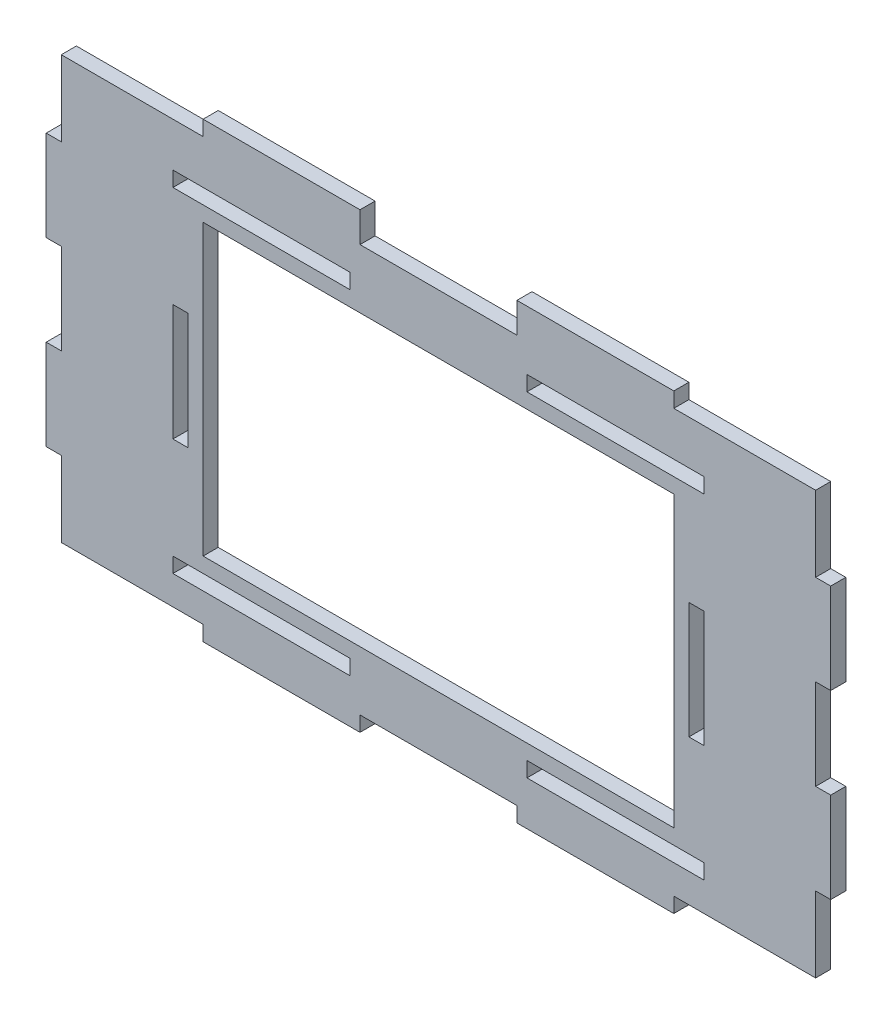
from build123d import *

# Parameters (mm, degrees)
SALIENTE_EXTRUIR1_DEPTH = 5
CROQUIS2_W              = 52
CROQUIS2_H              = 5
CORTAR_EXTRUIR1_DEPTH   = 10
CROQUIS3_W              = 5
CROQUIS3_H              = 38.6
CROQUIS3_W_2            = 156
CROQUIS3_H_2            = 95.8
CORTAR_EXTRUIR2_DEPTH   = 10


with BuildPart() as part:
    # Croquis1 → Saliente-Extruir1 (new body)
    with BuildSketch(Plane.XY):
        Polygon((52, 0), (104, 0), (104, 5), (156, 5), (156, 0), (208, 0), (208, 5), (255, 5), (255, 30), (260, 30), (260, 60), (255, 60), (255, 90), (260, 90), (260, 120), (255, 120), (255, 145), (208, 145), (208, 150), (156, 150), (156, 145), (104, 145), (104, 150), (52, 150), (52, 145), (5, 145), (5, 120), (0, 120), (0, 90), (5, 90), (5, 60), (0, 60), (0, 30), (5, 30), (5, 5), (52, 5), align=None)
    extrude(amount=SALIENTE_EXTRUIR1_DEPTH)

    # Croquis2 → Cortar-Extruir1 (cut)
    with BuildSketch(Plane.XY.offset(5)):
        with Locations((130, 142.5)):
            Rectangle(CROQUIS2_W, CROQUIS2_H)
    extrude(amount=-CORTAR_EXTRUIR1_DEPTH, mode=Mode.SUBTRACT)

    # Croquis3 → Cortar-Extruir2 (cut)
    with BuildSketch(Plane.XY.offset(5)):
        with Locations((44.5, 72.5)):
            Rectangle(CROQUIS3_W, CROQUIS3_H)
        with Locations((130, 72.5)):
            Rectangle(CROQUIS3_W_2, CROQUIS3_H_2)
        Polygon((47, 19.6), (100.666666667, 19.6), (100.666666667, 14.6), (42, 14.6), (42, 19.6), align=None)
        with Locations((215.5, 72.5)):
            Rectangle(CROQUIS3_W, CROQUIS3_H)
        Polygon((47, 125.4), (100.666666667, 125.4), (100.666666667, 130.4), (42, 130.4), (42, 125.4), align=None)
        Polygon((218, 130.4), (218, 125.4), (213, 125.4), (159.333333333, 125.4), (159.333333333, 130.4), align=None)
        Polygon((159.333333333, 14.6), (159.333333333, 19.6), (213, 19.6), (218, 19.6), (218, 14.6), align=None)
    extrude(amount=-CORTAR_EXTRUIR2_DEPTH, mode=Mode.SUBTRACT)


solid = part.part
